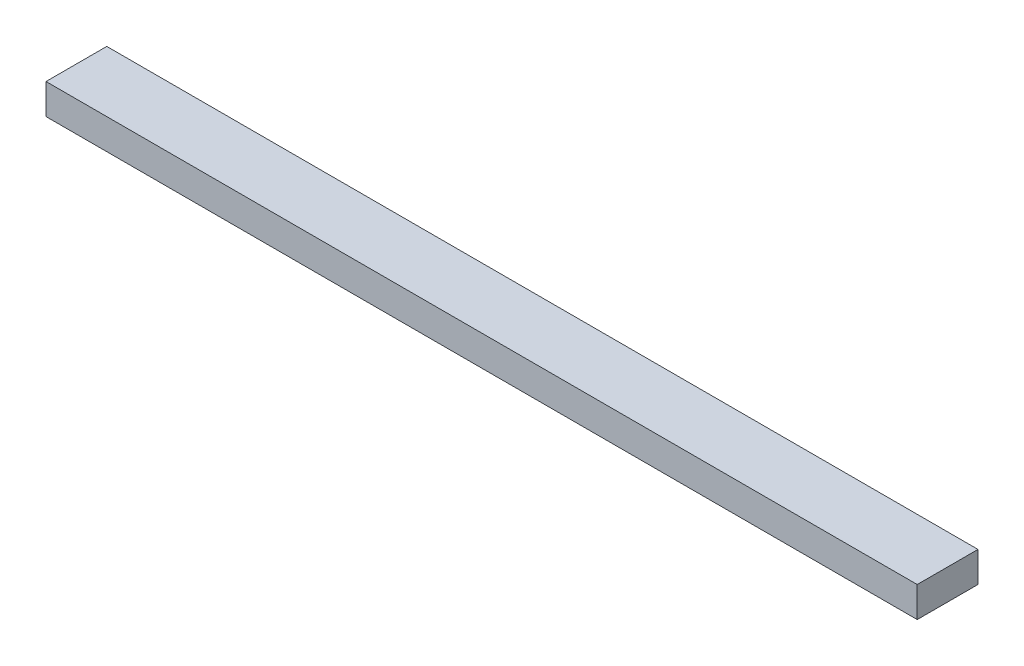
from build123d import *

# Parameters (mm, degrees)
SKETCH1_W           = 546.1
SKETCH1_H           = 19.05
BOSS_EXTRUDE1_DEPTH = 38.1


with BuildPart() as part:
    # Sketch1 → Boss-Extrude1 (new body)
    with BuildSketch(Plane.XY):
        with Locations((0, 142.875)):
            Rectangle(SKETCH1_W, SKETCH1_H)
    extrude(amount=BOSS_EXTRUDE1_DEPTH)


solid = part.part
